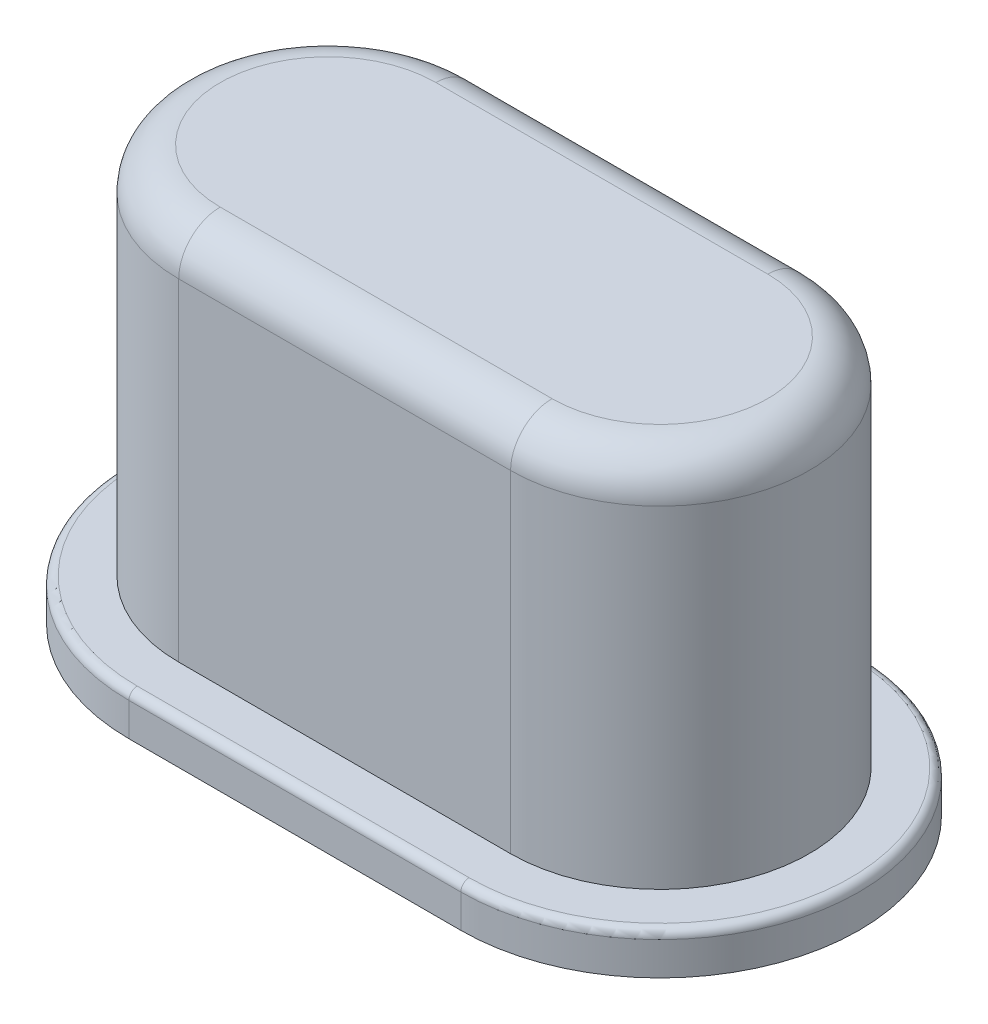
from build123d import *

# Parameters (mm, degrees)
BOSS_EXTRUDE1_DEPTH = 4.5
BOSS_EXTRUDE2_START = 0.5
BOSS_EXTRUDE2_DEPTH = 0.5
FILLET1_R           = 0.5
FILLET2_R           = 0.1


with BuildPart() as part:
    # Sketch1 → Boss-Extrude1 (new body)
    with BuildSketch(Plane(origin=(0, 0, 0), x_dir=(1, 0, 0), z_dir=(0, 1, 0))):
        with BuildLine():
            Line((-2, 1.8), (2, 1.8))
            ThreePointArc((2, 1.8), (3.8, 0), (2, -1.8))
            Line((2, -1.8), (-2, -1.8))
            ThreePointArc((-2, -1.8), (-3.8, 0), (-2, 1.8))
        make_face()
    extrude(amount=BOSS_EXTRUDE1_DEPTH)

    # Sketch2 → Boss-Extrude2 (add)
    # profile 1 of 2: a face of its own
    with BuildSketch(Plane.XZ.offset(BOSS_EXTRUDE2_START)):
        with BuildLine():
            Line((-2, -2.4), (2, -2.4))
            ThreePointArc((2, -2.4), (4.4, 0), (2, 2.4))
            Line((2, 2.4), (-2, 2.4))
            ThreePointArc((-2, 2.4), (-4.4, 0), (-2, -2.4))
        make_face()
        with BuildLine():
            ThreePointArc((-2, 1.8), (-3.8, 0), (-2, -1.8))
            Line((-2, -1.8), (2, -1.8))
            ThreePointArc((2, -1.8), (3.8, 0), (2, 1.8))
            Line((2, 1.8), (-2, 1.8))
        make_face(mode=Mode.SUBTRACT)
    # profile 2 of 2: a face of its own
    with BuildSketch(Plane.XZ.offset(BOSS_EXTRUDE2_START)):
        with BuildLine():
            Line((2, 1.8), (-2, 1.8))
            ThreePointArc((-2, 1.8), (-3.8, 0), (-2, -1.8))
            Line((-2, -1.8), (2, -1.8))
            ThreePointArc((2, -1.8), (3.8, 0), (2, 1.8))
        make_face()
    extrude(amount=-BOSS_EXTRUDE2_DEPTH)

    # Fillet1
    fillet1_edges = [part.edges().sort_by_distance(p)[0] for p in [
        (3.8, 4.5, 0),
        (0, 4.5, -1.8),
        (-3.8, 4.5, 0),
        (0, 4.5, 1.8),
    ]]
    fillet(fillet1_edges, radius=FILLET1_R)

    # Fillet2
    fillet2_edges = [part.edges().sort_by_distance(p)[0] for p in [
        (0, 0, -2.4),
        (4.4, 0, 0),
        (0, 0, 2.4),
        (-4.4, 0, 0),
    ]]
    fillet(fillet2_edges, radius=FILLET2_R)


solid = part.part
